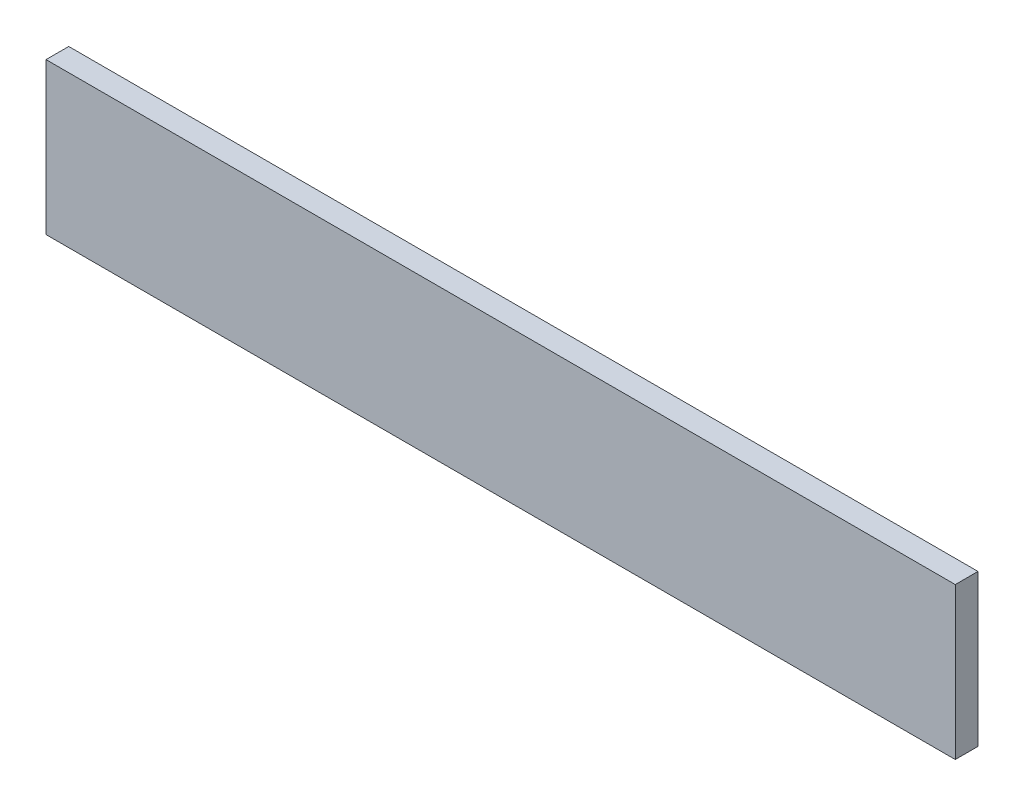
from build123d import *

# Parameters (mm, degrees)
SKETCH1_W           = 120
SKETCH1_H           = 20
BOSS_EXTRUDE1_DEPTH = 3


with BuildPart() as part:
    # Sketch1 → Boss-Extrude1 (new body)
    with BuildSketch(Plane.XY):
        Rectangle(SKETCH1_W, SKETCH1_H)
    extrude(amount=BOSS_EXTRUDE1_DEPTH)


solid = part.part
